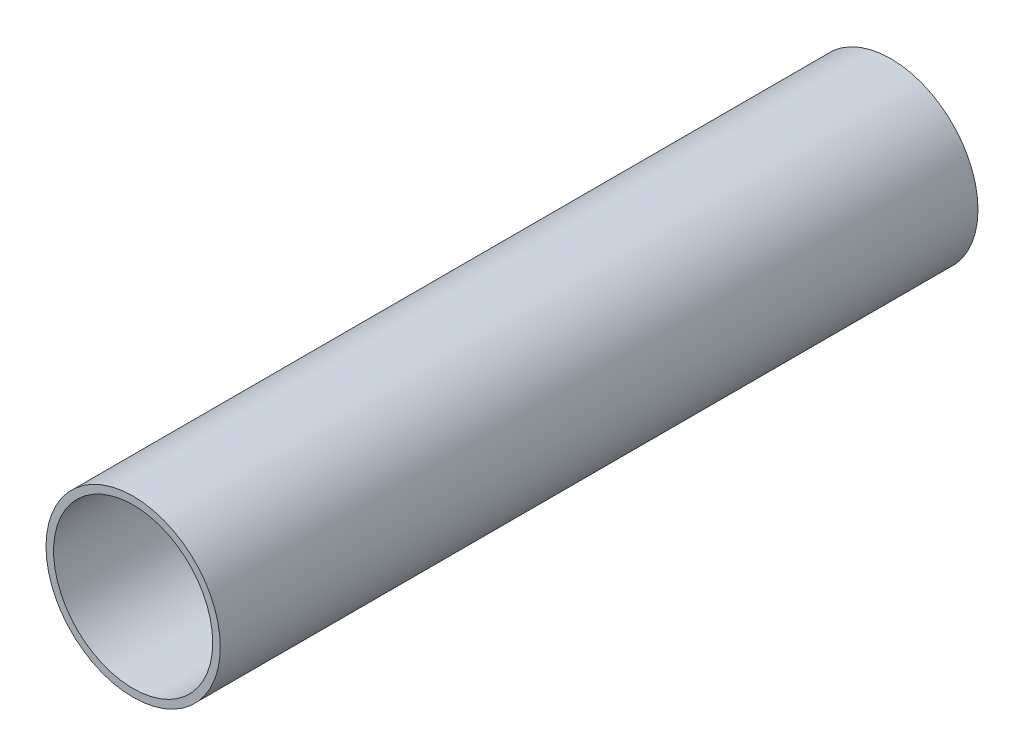
from build123d import *

# Parameters (mm, degrees)
ESQUISSE1_R        = 11.5
ESQUISSE1_R_2      = 10.5
BOSS_EXTRU_1_DEPTH = 100


with BuildPart() as part:
    # Esquisse1 → Boss.-Extru.1 (new body)
    with BuildSketch(Plane.XY):
        Circle(ESQUISSE1_R)
        Circle(ESQUISSE1_R_2, mode=Mode.SUBTRACT)
    extrude(amount=BOSS_EXTRU_1_DEPTH)


solid = part.part
